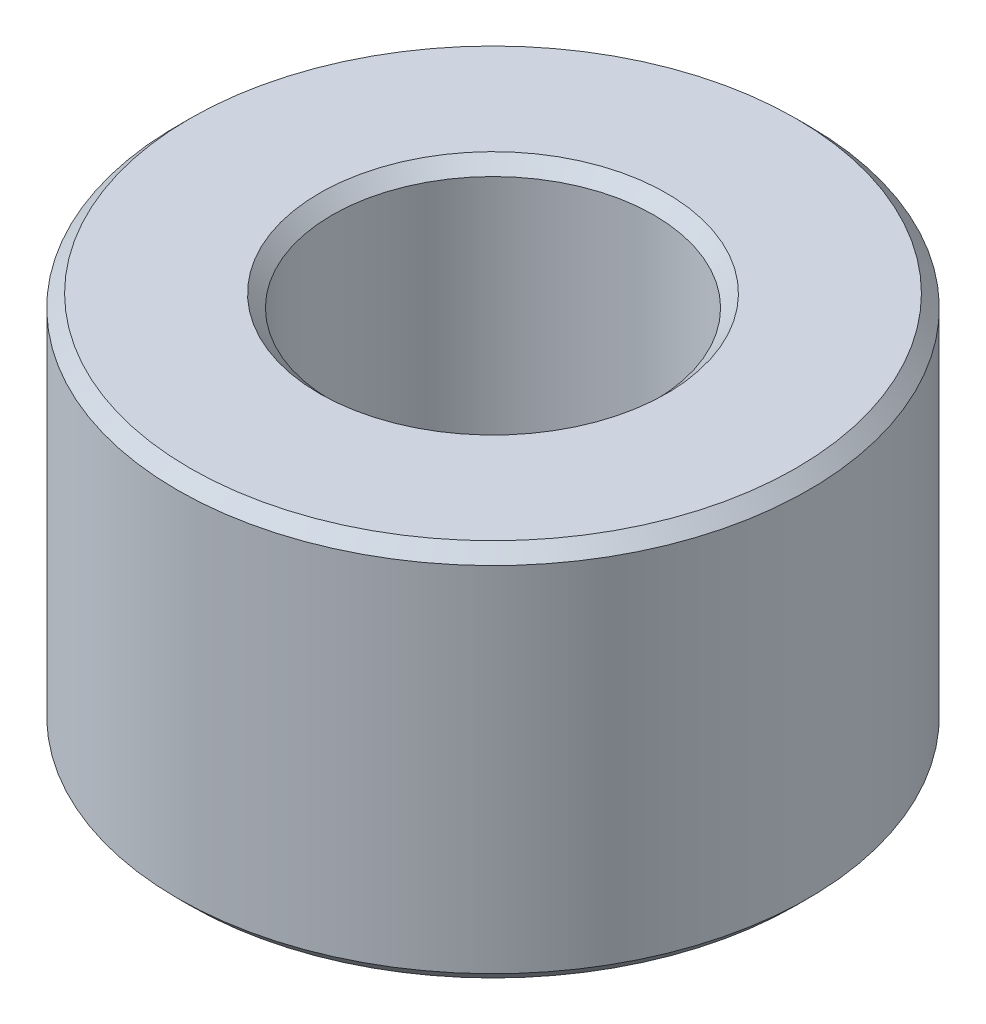
from build123d import *


with BuildPart() as part:
    # Sketch1 → Revolve1 (revolve)
    with BuildSketch(Plane(origin=(0, 0, 0), x_dir=(0, 0, -1), z_dir=(1, 0, 0)), mode=Mode.PRIVATE) as revolve1_sk:
        Polygon((2.55, 2.8), (2.75, 3), (4.8, 3), (5, 2.8), (5, -2.8), (4.8, -3), (2.75, -3), (2.55, -2.8), align=None)
    revolve(revolve1_sk.sketch.rotate(Axis((0, 2.133870968, 0), (0, -1, 0)), 180), axis=Axis((0, 2.133870968, 0), (0, -1, 0)))


solid = part.part
